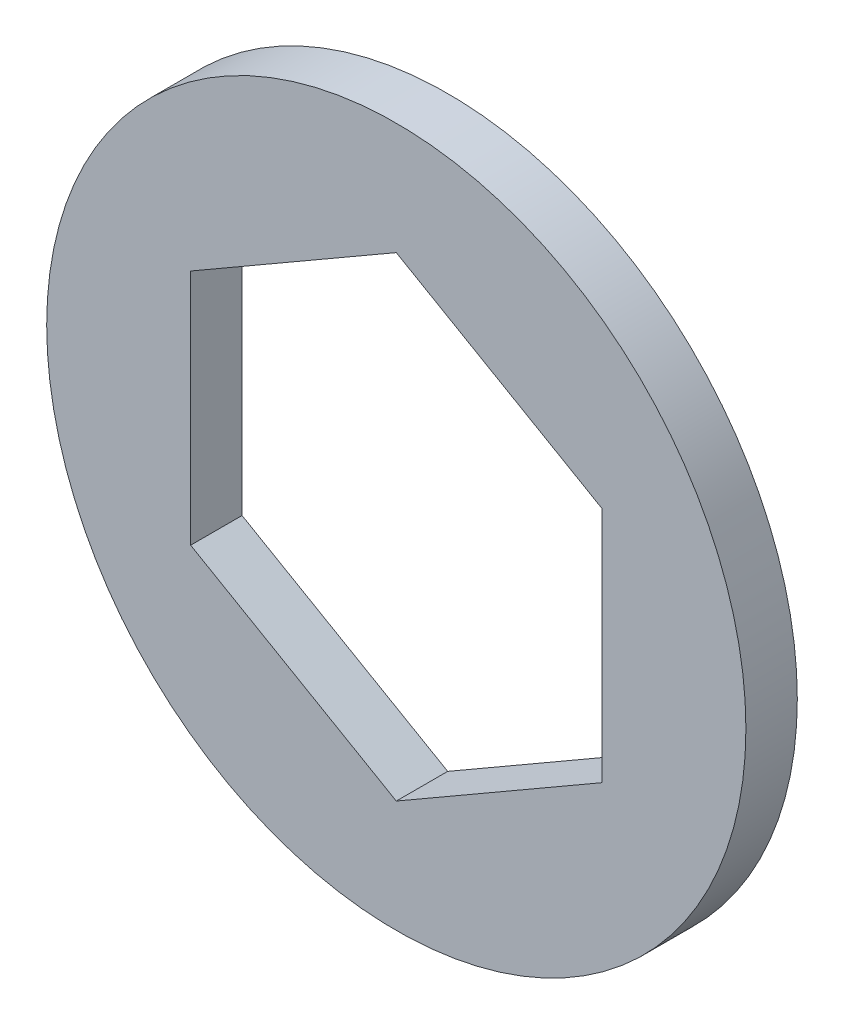
from build123d import *

# Parameters (mm, degrees)
SKETCH1_R           = 10.795
BOSS_EXTRUDE1_DEPTH = 0.79375


with BuildPart() as part:
    # Sketch1 → Boss-Extrude1 (new, symmetric)
    with BuildSketch(Plane.XY):
        Circle(SKETCH1_R)
        Polygon((0, 7.332348419), (-6.35, 3.666174209), (-6.35, -3.666174209), (0, -7.332348419), (6.35, -3.666174209), (6.35, 3.666174209), align=None, mode=Mode.SUBTRACT)
    extrude(amount=BOSS_EXTRUDE1_DEPTH, both=True)


solid = part.part
